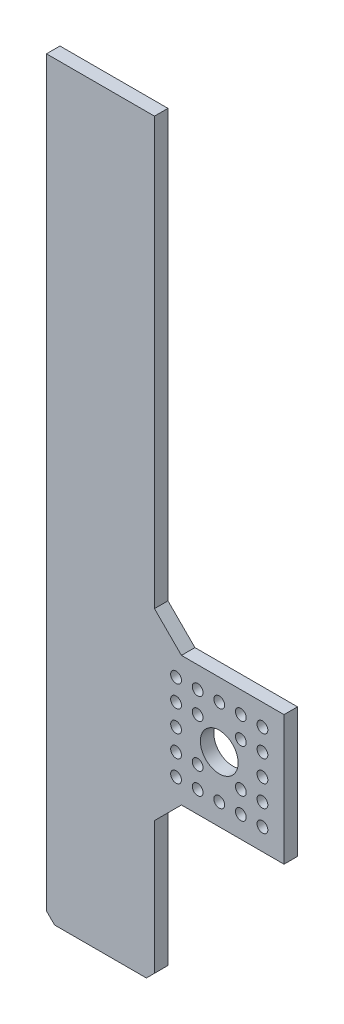
from build123d import *

# Parameters (mm, degrees)
SKETCH1_R           = 7
SKETCH1_R_2         = 2
BOSS_EXTRUDE1_DEPTH = 5
CHAMFER2_SIZE       = 3
CHAMFER3_SIZE       = 10


with BuildPart() as part:
    # Sketch1 → Boss-Extrude1 (new body)
    with BuildSketch(Plane.XY):
        Polygon((0, 0), (0, -278), (40, -278), (40, -216), (88, -216), (88, -168), (40, -168), (40, 0), align=None)
        with Locations((64, -192)):
            Circle(SKETCH1_R, mode=Mode.SUBTRACT)
        with Locations((48, -176)):
            Circle(SKETCH1_R_2, mode=Mode.SUBTRACT)
        with Locations((56, -176)):
            Circle(SKETCH1_R_2, mode=Mode.SUBTRACT)
        with Locations((64, -176)):
            Circle(SKETCH1_R_2, mode=Mode.SUBTRACT)
        with Locations((72, -176)):
            Circle(SKETCH1_R_2, mode=Mode.SUBTRACT)
        with Locations((80, -176)):
            Circle(SKETCH1_R_2, mode=Mode.SUBTRACT)
        with Locations((56, -184)):
            Circle(SKETCH1_R_2, mode=Mode.SUBTRACT)
        with Locations((72, -184)):
            Circle(SKETCH1_R_2, mode=Mode.SUBTRACT)
        with Locations((80, -184)):
            Circle(SKETCH1_R_2, mode=Mode.SUBTRACT)
        with Locations((80, -192)):
            Circle(SKETCH1_R_2, mode=Mode.SUBTRACT)
        with Locations((56, -200)):
            Circle(SKETCH1_R_2, mode=Mode.SUBTRACT)
        with Locations((72, -200)):
            Circle(SKETCH1_R_2, mode=Mode.SUBTRACT)
        with Locations((80, -200)):
            Circle(SKETCH1_R_2, mode=Mode.SUBTRACT)
        with Locations((56, -208)):
            Circle(SKETCH1_R_2, mode=Mode.SUBTRACT)
        with Locations((64, -208)):
            Circle(SKETCH1_R_2, mode=Mode.SUBTRACT)
        with Locations((72, -208)):
            Circle(SKETCH1_R_2, mode=Mode.SUBTRACT)
        with Locations((80, -208)):
            Circle(SKETCH1_R_2, mode=Mode.SUBTRACT)
        with Locations((48, -184)):
            Circle(SKETCH1_R_2, mode=Mode.SUBTRACT)
        with Locations((48, -192)):
            Circle(SKETCH1_R_2, mode=Mode.SUBTRACT)
        with Locations((48, -200)):
            Circle(SKETCH1_R_2, mode=Mode.SUBTRACT)
        with Locations((48, -208)):
            Circle(SKETCH1_R_2, mode=Mode.SUBTRACT)
    extrude(amount=BOSS_EXTRUDE1_DEPTH)

    # Chamfer2
    chamfer2_edges = [part.edges().sort_by_distance(p)[0] for p in [
        (40, -278, 2.5),
        (0, -278, 2.5),
    ]]
    chamfer(chamfer2_edges, length=CHAMFER2_SIZE)

    # Chamfer3
    chamfer3_edges = [part.edges().sort_by_distance(p)[0] for p in [
        (40, -168, 2.5),
        (40, -216, 2.5),
    ]]
    chamfer(chamfer3_edges, length=CHAMFER3_SIZE)


solid = part.part
